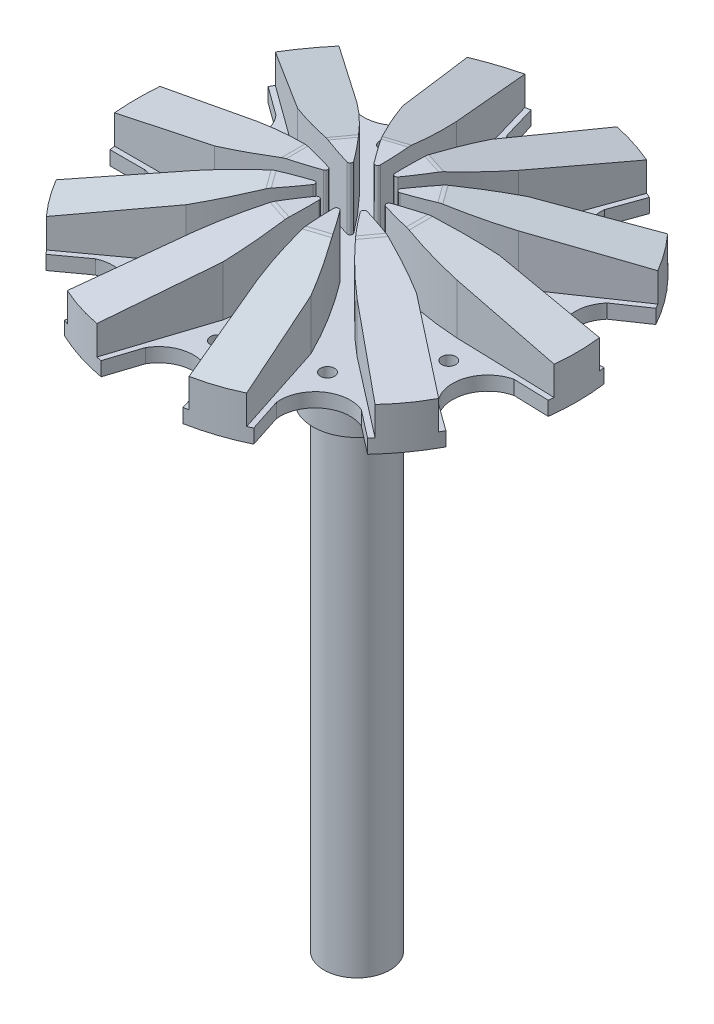
from build123d import *

# Parameters (mm, degrees)
SKETCH1_R                    = 41.91
IMPELLER_PLATE_DEPTH         = 2.032
FIRST_VANE_DEPTH             = 10.16
VANE_ANGLE_CUT_DEPTH         = 61.51066901
VANE_ANGLE_CUT_DEPTH_BACK    = 61.51066901
VANE_PATTERN_COUNT           = 10
SKETCH10_R                   = 1.5875
BALANCE_CUTS_DEPTH           = 10.16
SKETCH11_R                   = 6.35
BOSS_EXTRUDE1_DEPTH          = 15.846806
FILLET4_R                    = 6.35
SKETCH14_R                   = 4.7625
BOSS_EXTRUDE2_DEPTH          = 68.707
SKETCH15_W                   = 13.074355289
SKETCH15_H                   = 86.690038672
SKETCH16_R                   = 9.652
VANE_FACE_PARALLEL_CUT_DEPTH = 0.5842
FILLET5_R                    = 10.16
CUT_EXTRUDE2_REACH           = 112.853
SKETCH17_R                   = 38.1
SKETCH17_R_2                 = 31.75
CUT_EXTRUDE3_START           = 98.535771903
CUT_EXTRUDE3_DEPTH           = 101.075771903
CIRPATTERN3_COUNT            = 10
SKETCH19_R                   = 1.016
CUT_EXTRUDE4_DEPTH           = 2.032
CIRPATTERN4_COUNT            = 10
FILLET7_R                    = 0.381
SKETCH20_R                   = 9.144
CUT_EXTRUDE5_DEPTH           = 1.283119283
FILLET8_R                    = 2.54


with BuildPart() as part:
    # Sketch1 → Impeller Plate (new body)
    with BuildSketch(Plane(origin=(0, 0, 0), x_dir=(1, 0, 0), z_dir=(0, 1, 0))):
        with Locations(Location((0, 0, 0), (0, 0, 270))):
            Circle(SKETCH1_R)
    extrude(amount=IMPELLER_PLATE_DEPTH)

    # Sketch8 → First Vane (add)
    with BuildSketch(Plane(origin=(0, 2.032, 0), x_dir=(1, 0, 0), z_dir=(0, 1, 0))):
        with BuildLine():
            Line((41.768433397, 3.441812249), (17.116970715, 3.441812249))
            ThreePointArc((17.116970715, 3.441812249), (10.195032205, 2.051802513), (3.450260899, -0.03468253))
            ThreePointArc((3.450260899, -0.03468253), (10.193363736, -1.83103124), (17.116970715, -2.702794368))
            Line((17.116970715, -2.702794368), (41.768433397, -3.441812249))
            ThreePointArc((41.768433397, -3.441812249), (41.91, 0), (41.768433397, 3.441812249))
        make_face()
    extrude(amount=FIRST_VANE_DEPTH)

    # Sketch9 → Vane Angle Cut (cut, two sides: drawn at the far end of the back side and taken through both)
    with BuildSketch(Plane.XY.offset(-VANE_ANGLE_CUT_DEPTH_BACK)):
        Polygon((3.450260899, 12.192), (41.91, 12.192), (41.91, 4.017130094), align=None)
    extrude(amount=VANE_ANGLE_CUT_DEPTH + VANE_ANGLE_CUT_DEPTH_BACK, mode=Mode.SUBTRACT)


with BuildPart() as vane_pattern_1:
    # Vane Pattern: pattern copy
    add(part.part.rotate(Axis((0, 0, 0), (0, 1, 0)), 1 * 360 / VANE_PATTERN_COUNT))


with BuildPart() as vane_pattern_2:
    # Vane Pattern: pattern copy
    add(part.part.rotate(Axis((0, 0, 0), (0, 1, 0)), 2 * 360 / VANE_PATTERN_COUNT))


with BuildPart() as vane_pattern_3:
    # Vane Pattern: pattern copy
    add(part.part.rotate(Axis((0, 0, 0), (0, 1, 0)), 3 * 360 / VANE_PATTERN_COUNT))


with BuildPart() as vane_pattern_4:
    # Vane Pattern: pattern copy
    add(part.part.rotate(Axis((0, 0, 0), (0, 1, 0)), 4 * 360 / VANE_PATTERN_COUNT))


with BuildPart() as vane_pattern_5:
    # Vane Pattern: pattern copy
    add(part.part.rotate(Axis((0, 0, 0), (0, 1, 0)), 5 * 360 / VANE_PATTERN_COUNT))


with BuildPart() as vane_pattern_6:
    # Vane Pattern: pattern copy
    add(part.part.rotate(Axis((0, 0, 0), (0, 1, 0)), 6 * 360 / VANE_PATTERN_COUNT))


with BuildPart() as vane_pattern_7:
    # Vane Pattern: pattern copy
    add(part.part.rotate(Axis((0, 0, 0), (0, 1, 0)), 7 * 360 / VANE_PATTERN_COUNT))


with BuildPart() as vane_pattern_8:
    # Vane Pattern: pattern copy
    add(part.part.rotate(Axis((0, 0, 0), (0, 1, 0)), 8 * 360 / VANE_PATTERN_COUNT))


with BuildPart() as vane_pattern_9:
    # Vane Pattern: pattern copy
    add(part.part.rotate(Axis((0, 0, 0), (0, 1, 0)), 9 * 360 / VANE_PATTERN_COUNT))


with BuildPart() as balance_cuts_tool:
    # Sketch10 → Balance Cuts (new body)
    with BuildSketch(Plane(origin=(0, 2.032, 0), x_dir=(1, 0, 0), z_dir=(0, 1, 0))):
        with Locations(Location((-12.739074523, -17.697795014, 0), (0, 0, 270))):
            Circle(SKETCH10_R)
        with BuildLine():
            Line((-31.26396456, -27.910797552), (-24.438938581, -22.952125923))
            ThreePointArc((-24.438938581, -22.952125923), (-16.841308888, -23.396527612), (-14.058143437, -30.479991446))
            Line((-14.058143437, -30.479991446), (-16.882044385, -38.359414456))
            ThreePointArc((-16.882044385, -38.359414456), (-24.75533858, -34.074299656), (-31.26396456, -27.910797552))
        make_face()
    extrude(amount=-BALANCE_CUTS_DEPTH)


with BuildPart() as part_1:
    add(part.part)

    # Balance Cuts: cut by balance_cuts_tool
    add(balance_cuts_tool.part, mode=Mode.SUBTRACT)



with BuildPart() as vane_pattern_1_1:
    add(vane_pattern_1.part)

    # Balance Cuts: cut by balance_cuts_tool
    add(balance_cuts_tool.part, mode=Mode.SUBTRACT)


with BuildPart() as vane_pattern_2_1:
    add(vane_pattern_2.part)

    # Balance Cuts: cut by balance_cuts_tool
    add(balance_cuts_tool.part, mode=Mode.SUBTRACT)


with BuildPart() as vane_pattern_3_1:
    add(vane_pattern_3.part)

    # Balance Cuts: cut by balance_cuts_tool
    add(balance_cuts_tool.part, mode=Mode.SUBTRACT)


with BuildPart() as vane_pattern_4_1:
    add(vane_pattern_4.part)

    # Balance Cuts: cut by balance_cuts_tool
    add(balance_cuts_tool.part, mode=Mode.SUBTRACT)


with BuildPart() as vane_pattern_5_1:
    add(vane_pattern_5.part)

    # Balance Cuts: cut by balance_cuts_tool
    add(balance_cuts_tool.part, mode=Mode.SUBTRACT)


with BuildPart() as vane_pattern_6_1:
    add(vane_pattern_6.part)

    # Balance Cuts: cut by balance_cuts_tool
    add(balance_cuts_tool.part, mode=Mode.SUBTRACT)


with BuildPart() as vane_pattern_7_1:
    add(vane_pattern_7.part)

    # Balance Cuts: cut by balance_cuts_tool
    add(balance_cuts_tool.part, mode=Mode.SUBTRACT)


with BuildPart() as part_2:
    add(part_1.part)

    add(vane_pattern_1_1.part)  # Boss-Extrude1 merges Vane Pattern_1

    add(vane_pattern_2_1.part)  # Boss-Extrude1 merges Vane Pattern_2

    add(vane_pattern_3_1.part)  # Boss-Extrude1 merges Vane Pattern_3

    add(vane_pattern_4_1.part)  # Boss-Extrude1 merges Vane Pattern_4

    add(vane_pattern_5_1.part)  # Boss-Extrude1 merges Vane Pattern_5

    add(vane_pattern_6_1.part)  # Boss-Extrude1 merges Vane Pattern_6

    add(vane_pattern_7_1.part)  # Boss-Extrude1 merges Vane Pattern_7

    add(vane_pattern_8.part)  # Boss-Extrude1 merges Vane Pattern_8

    add(vane_pattern_9.part)  # Boss-Extrude1 merges Vane Pattern_9
    # Sketch11 → Boss-Extrude1 (add)
    with BuildSketch(Plane.XZ):
        with Locations(Location((0, 0, 0), (0, 0, 90))):
            Circle(SKETCH11_R)
    extrude(amount=BOSS_EXTRUDE1_DEPTH)

    # Fillet4
    fillet4_edges = [part_2.edges().sort_by_distance(p)[0] for p in [
        (0, 0, -6.35),
    ]]
    fillet(fillet4_edges, radius=FILLET4_R)

    # Sketch14 → Boss-Extrude2 (add)
    with BuildSketch(Plane(origin=(0, -15.846806, 0), x_dir=(-1, 0, 0), z_dir=(0, -1, 0))):
        with Locations(Location((0, 0, 0), (0, 0, 90))):
            Circle(SKETCH14_R)
    extrude(amount=BOSS_EXTRUDE2_DEPTH)

    # Sketch15 → Diameter Trim (revolve, cut)
    with BuildSketch(Plane(origin=(0, 0, 0), x_dir=(0, 0, -1), z_dir=(1, 0, 0))):
        with Locations((-44.637177644, -28.655221466)):
            Rectangle(SKETCH15_W, SKETCH15_H)
    revolve(axis=Axis((0, 0, 0), (0, -1, 0)), mode=Mode.SUBTRACT)

    # Sketch16 → Vane Face Parallel Cut (cut)
    with BuildSketch(Plane(origin=(0, 12.322890518, 0), x_dir=(1, 0, 0), z_dir=(0, 1, 0))):
        Circle(SKETCH16_R)
    extrude(amount=-VANE_FACE_PARALLEL_CUT_DEPTH, mode=Mode.SUBTRACT)

    # Fillet5
    fillet5_edges = [part_2.edges().sort_by_distance(p)[0] for p in [
        (-5.582914337, 11.738690518, -0.001075617),
        (-4.517304809, 11.738690518, 3.28068452),
        (-1.726238381, 11.738690518, 5.309334676),
        (1.724192435, 11.738690518, 5.309999444),
        (4.516040345, 11.738690518, 3.282424905),
        (5.582914337, 11.738690518, 0.001075617),
        (4.517304809, 11.738690518, -3.28068452),
        (1.726238381, 11.738690518, -5.309334676),
        (-1.724192435, 11.738690518, -5.309999444),
        (-4.516040345, 11.738690518, -3.282424905),
    ]]
    fillet(fillet5_edges, radius=FILLET5_R)

    # Cut-Extrude2: up to this face of the body (flat: up to its plane)
    cut_extrude2_end = Plane(part_2.part.faces().sort_by_distance((0, 0, -37.022369265))[0])
    # Sketch17 → Cut-Extrude2 (cut, up to the picked face)
    with BuildSketch(Plane(origin=(0, 12.322890518, 0), x_dir=(1, 0, 0), z_dir=(0, 1, 0)), mode=Mode.PRIVATE) as cut_extrude2_sk1:
        Circle(SKETCH17_R)
        with Locations(Location((0, 0, 0), (0, 0, 270))):
            Circle(SKETCH17_R_2, mode=Mode.SUBTRACT)
    cut_extrude2_tool1 = split(extrude(cut_extrude2_sk1.sketch, amount=-CUT_EXTRUDE2_REACH, mode=Mode.PRIVATE), bisect_by=cut_extrude2_end, keep=Keep.BOTH, mode=Mode.PRIVATE)
    add(cut_extrude2_tool1.solids().sort_by(Axis((-37.022369, 12.322891, 0), (0, -1, 0)))[0], mode=Mode.SUBTRACT)

    # Sketch18 → Cut-Extrude3 (cut)
    with BuildSketch(Plane(origin=(0, 2.032, 0), x_dir=(1, 0, 0), z_dir=(0, 1, 0)).offset(CUT_EXTRUDE3_START)):
        with BuildLine():
            Line((-18.879399626, -18.912884436), (-22.989205958, -21.898833518))
            ThreePointArc((-22.989205958, -21.898833518), (-18.536674251, -25.777009285), (-13.443025108, -28.763650254))
            Line((-13.443025108, -28.763650254), (-11.729150826, -23.981492274))
            ThreePointArc((-11.729150826, -23.981492274), (-13.852412895, -19.399056557), (-18.879399626, -18.912884436))
        make_face()
    cut_extrude3 = extrude(amount=-CUT_EXTRUDE3_DEPTH, mode=Mode.SUBTRACT)

    # CirPattern3: Cut-Extrude3 ×10 about axis
    cirpattern3_axis = Axis((0, 0, 0), (0, 1, 0))
    for i in range(1, CIRPATTERN3_COUNT):
        add(cut_extrude3.rotate(cirpattern3_axis, i * 360 / CIRPATTERN3_COUNT), mode=Mode.SUBTRACT)

    # Sketch19 → Cut-Extrude4 (cut)
    with BuildSketch(Plane(origin=(0, 2.032, 0), x_dir=(1, 0, 0), z_dir=(0, 1, 0))):
        with Locations(Location((-11.808470495, -16.536699325, 0), (0, 0, 270))):
            Circle(SKETCH19_R)
    cut_extrude4 = extrude(amount=-CUT_EXTRUDE4_DEPTH, mode=Mode.SUBTRACT)

    # CirPattern4: Cut-Extrude4 ×10 about axis
    cirpattern4_axis = Axis((0, 0, 0), (0, 1, 0))
    for i in range(1, CIRPATTERN4_COUNT):
        add(cut_extrude4.rotate(cirpattern4_axis, i * 360 / CIRPATTERN4_COUNT), mode=Mode.SUBTRACT)

    # Fillet7
    fillet7_edges = [part_2.edges().sort_by_distance(p)[0] for p in [
        (2.770933823, 6.885345259, 2.056071229),
        (1.033204207, 6.885345259, 3.292110602),
        (-1.099174299, 6.885345259, 3.27067562),
        (-2.811705582, 6.885345259, 1.999953717),
        (-3.450260899, 6.885345259, -0.03468253),
        (-2.770933823, 6.885345259, -2.056071229),
        (-1.033204207, 6.885345259, -3.292110602),
        (1.099174299, 6.885345259, -3.27067562),
        (2.811705582, 6.885345259, -1.999953717),
        (3.450260899, 6.885345259, 0.03468253),
    ]]
    fillet(fillet7_edges, radius=FILLET7_R)

    # Sketch20 → Cut-Extrude5 (cut)
    with BuildSketch(Plane(origin=(0, 12.322890518, 0), x_dir=(1, 0, 0), z_dir=(0, 1, 0))):
        Circle(SKETCH20_R)
    extrude(amount=-CUT_EXTRUDE5_DEPTH, mode=Mode.SUBTRACT)

    # Fillet8
    fillet8_edges = [part_2.edges().sort_by_distance(p)[0] for p in [
        (-2.671807213, 11.039771235, 8.459473298),
        (-7.133891088, 11.039771235, 5.273408785),
        (-8.87107104, 11.039771235, 0.073081352),
        (-7.21980337, 11.039771235, -5.155160673),
        (-2.810816206, 11.039771235, -8.414306539),
        (2.671807213, 11.039771235, -8.459473298),
        (7.133891088, 11.039771235, -5.273408785),
        (8.87107104, 11.039771235, -0.073081352),
        (7.21980337, 11.039771235, 5.155160673),
        (2.810816206, 11.039771235, 8.414306539),
    ]]
    fillet(fillet8_edges, radius=FILLET8_R)


solid = part_2.part
